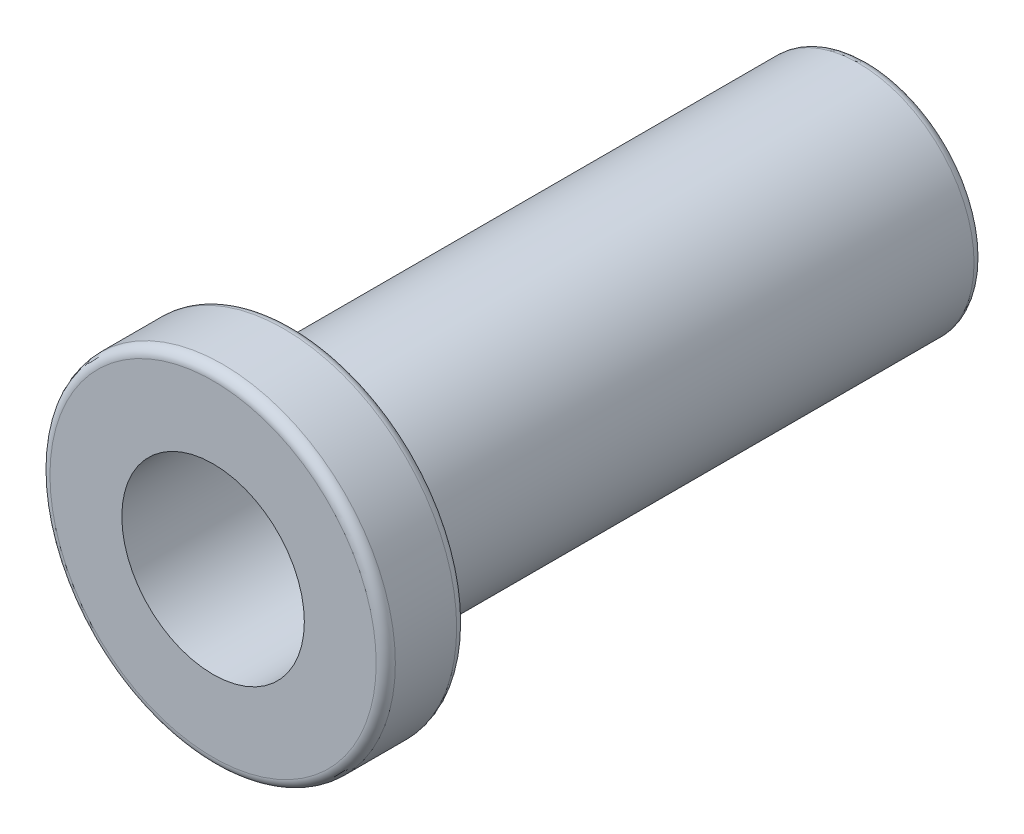
from build123d import *

# Parameters (mm, degrees)
RESSALTO_EXTRUS_O1_DEPTH      = 4.2
RESSALTO_EXTRUS_O1_DEPTH_BACK = 30
ESBO_O1_R                     = 6.0125
ESBO_O1_R_2                   = 4.7625
ESBO_O2_R                     = 9.0125
ESBO_O2_R_2                   = 6.0125
RESSALTO_EXTRUS_O2_DEPTH      = 4.2
FILETE2_R                     = 0.5


with BuildPart() as part:
    # Esboço1 → Ressalto-extrusão1 (new, two sides: drawn at the far end of the back side and taken through both)
    with BuildSketch(Plane.XY.offset(-0.404551317).offset(-RESSALTO_EXTRUS_O1_DEPTH_BACK)):
        with Locations((70.795334041, 51.25825559)):
            Circle(ESBO_O1_R)
        with Locations((70.795334041, 51.25825559)):
            Circle(ESBO_O1_R_2, mode=Mode.SUBTRACT)
    extrude(amount=RESSALTO_EXTRUS_O1_DEPTH + RESSALTO_EXTRUS_O1_DEPTH_BACK)

    # Esboço2 → Ressalto-extrusão2 (add)
    with BuildSketch(Plane.XY.offset(-0.404551317)):
        with Locations((70.795334041, 51.25825559)):
            Circle(ESBO_O2_R)
        with Locations((70.795334041, 51.25825559)):
            Circle(ESBO_O2_R_2, mode=Mode.SUBTRACT)
    extrude(amount=RESSALTO_EXTRUS_O2_DEPTH)

    # Filete2
    filete2_edges = [part.edges().sort_by_distance(p)[0] for p in [
        (61.782834041, 51.25825559, -0.404551317),
        (64.782834041, 51.25825559, -30.404551317),
        (61.782834041, 51.25825559, 3.795448683),
    ]]
    fillet(filete2_edges, radius=FILETE2_R)


solid = part.part
